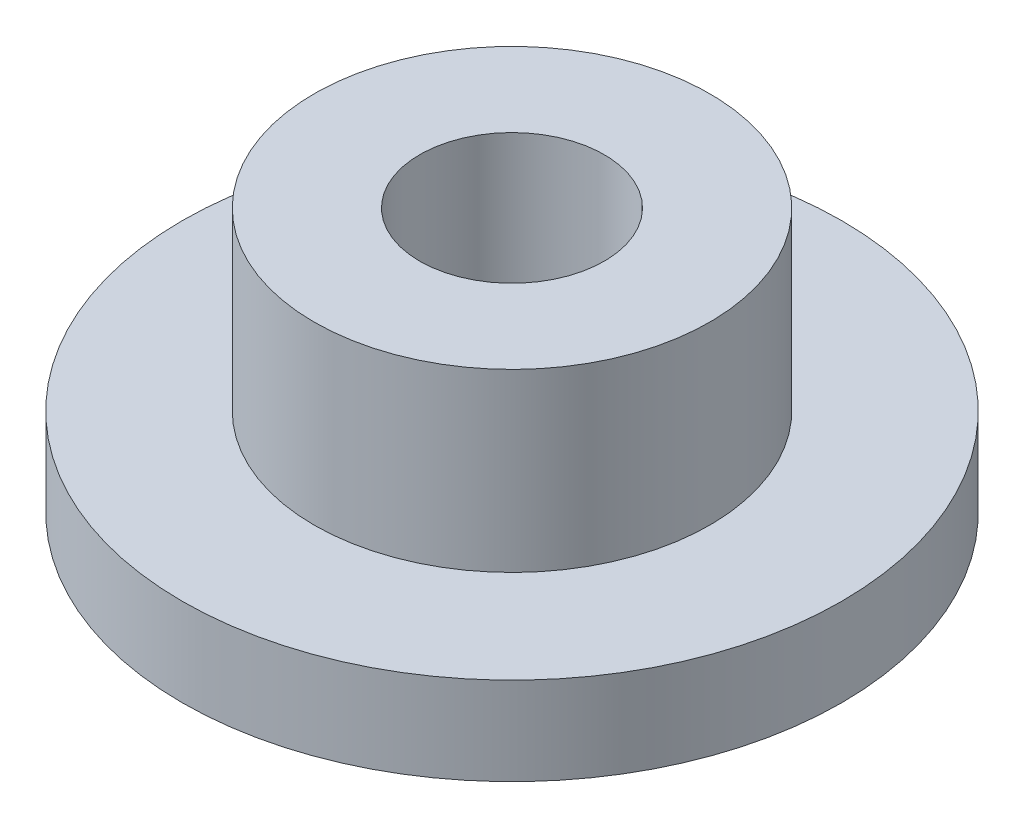
from build123d import *

# Parameters (mm, degrees)
SKETCH1_R           = 3.75
BOSS_EXTRUDE1_DEPTH = 1
SKETCH2_R           = 2.25
BOSS_EXTRUDE2_DEPTH = 2
SKETCH3_R           = 1.05
CUT_EXTRUDE1_DEPTH  = 3


with BuildPart() as part:
    # Sketch1 → Boss-Extrude1 (new body)
    with BuildSketch(Plane(origin=(0, 0, 0), x_dir=(1, 0, 0), z_dir=(0, 1, 0))):
        with Locations(Location((0, 0, 0), (0, 0, 270))):
            Circle(SKETCH1_R)
    extrude(amount=BOSS_EXTRUDE1_DEPTH)

    # Sketch2 → Boss-Extrude2 (add)
    with BuildSketch(Plane(origin=(0, 1, 0), x_dir=(1, 0, 0), z_dir=(0, 1, 0))):
        with Locations(Location((0, 0, 0), (0, 0, 270))):
            Circle(SKETCH2_R)
    extrude(amount=BOSS_EXTRUDE2_DEPTH)

    # Sketch3 → Cut-Extrude1 (cut)
    with BuildSketch(Plane(origin=(0, 3, 0), x_dir=(1, 0, 0), z_dir=(0, 1, 0))):
        with Locations(Location((0, 0, 0), (0, 0, 270))):
            Circle(SKETCH3_R)
    extrude(amount=-CUT_EXTRUDE1_DEPTH, mode=Mode.SUBTRACT)


solid = part.part
